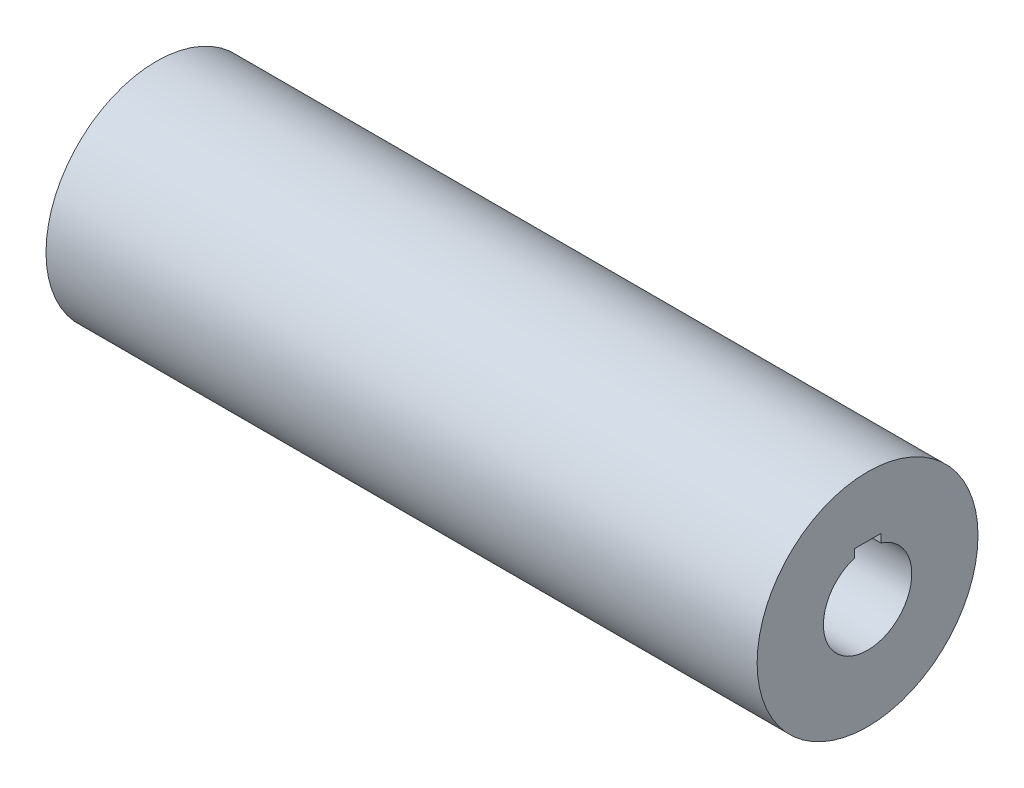
from build123d import *

# Parameters (mm, degrees)
SKETCH1_R           = 25
SKETCH1_R_2         = 10
BOSS_EXTRUDE1_DEPTH = 80.5
SKETCH3_W           = 6
SKETCH3_H           = 2.8
CUT_EXTRUDE1_DEPTH  = 80.5


with BuildPart() as part:
    # Sketch1 → Boss-Extrude1 (new, symmetric)
    with BuildSketch(Plane(origin=(0, 0, 0), x_dir=(0, 0, -1), z_dir=(1, 0, 0))):
        Circle(SKETCH1_R)
        Circle(SKETCH1_R_2, mode=Mode.SUBTRACT)
    extrude(amount=BOSS_EXTRUDE1_DEPTH, both=True)

    # Sketch3 → Cut-Extrude1 (cut, symmetric)
    with BuildSketch(Plane(origin=(0, 0, 0), x_dir=(0, 0, -1), z_dir=(1, 0, 0))):
        with Locations((0, 10)):
            Rectangle(SKETCH3_W, SKETCH3_H)
    extrude(amount=CUT_EXTRUDE1_DEPTH, both=True, mode=Mode.SUBTRACT)


solid = part.part
